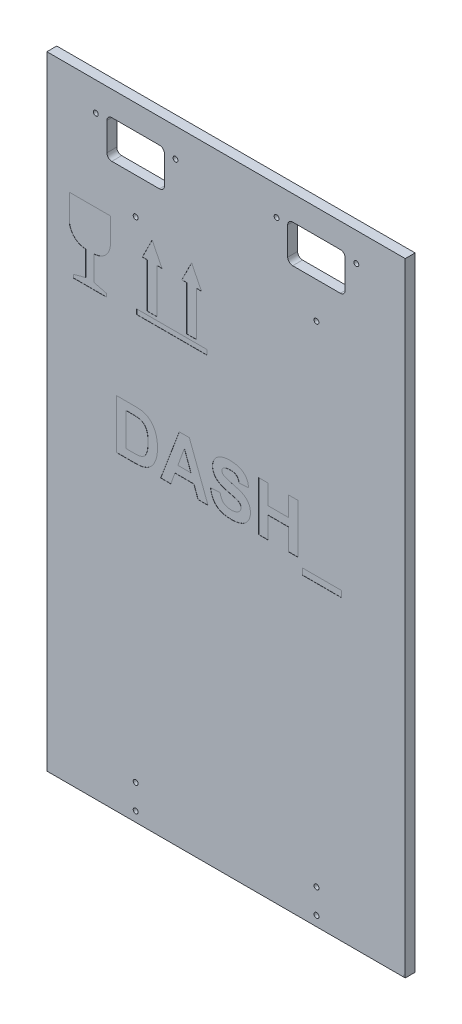
from build123d import *

# Parameters (mm, degrees)
SKETCH_1_W          = 218
SKETCH_1_H          = 379
SKETCH_1_R          = 1.5
SKETCH_1_W_2        = 35
SKETCH_1_H_2        = 23
EXTRUDE_1_DEPTH     = 6
FILLET_1_R          = 3
SKETCH_2_R          = 0.5
SKETCH_2_W          = 42.883956532
SKETCH_2_H          = 3
SKETCH_2_W_2        = 23.846153846
SKETCH_2_H_2        = 3.846153846
CUT_EXTRUDE_1_DEPTH = 0.1


with BuildPart() as part:
    # Эскиз1 → Бобышка-Вытянуть1 (new body)
    with BuildSketch(Plane.XY):
        with Locations((0, 136.5)):
            Rectangle(SKETCH_1_W, SKETCH_1_H)
        with Locations((-55, -47)):
            Circle(SKETCH_1_R, mode=Mode.SUBTRACT)
        with Locations((-55, -32)):
            Circle(SKETCH_1_R, mode=Mode.SUBTRACT)
        with Locations(Location((55, -32, 0), (0, 0, 180))):
            Circle(SKETCH_1_R, mode=Mode.SUBTRACT)
        with Locations(Location((55, -47, 0), (0, 0, 180))):
            Circle(SKETCH_1_R, mode=Mode.SUBTRACT)
        with Locations((-79.25, 308.5)):
            Circle(SKETCH_1_R, mode=Mode.SUBTRACT)
        with Locations((-55, 266)):
            Circle(SKETCH_1_R, mode=Mode.SUBTRACT)
        with Locations(Location((-30.75, 308.5, 0), (0, 0, 180))):
            Circle(SKETCH_1_R, mode=Mode.SUBTRACT)
        with Locations((30.75, 308.5)):
            Circle(SKETCH_1_R, mode=Mode.SUBTRACT)
        with Locations(Location((55, 266, 0), (0, 0, 180))):
            Circle(SKETCH_1_R, mode=Mode.SUBTRACT)
        with Locations(Location((79.25, 308.5, 0), (0, 0, 180))):
            Circle(SKETCH_1_R, mode=Mode.SUBTRACT)
        with Locations((55, 299.5)):
            Rectangle(SKETCH_1_W_2, SKETCH_1_H_2, mode=Mode.SUBTRACT)
        with Locations((-55, 299.5)):
            Rectangle(SKETCH_1_W_2, SKETCH_1_H_2, mode=Mode.SUBTRACT)
    extrude(amount=EXTRUDE_1_DEPTH)

    # Скругление1
    fillet_1_edges = [part.edges().sort_by_distance(p)[0] for p in [
        (-72.5, 311, 3),
        (-72.5, 288, 3),
        (-37.5, 288, 3),
        (-37.5, 311, 3),
        (37.5, 288, 3),
        (72.5, 288, 3),
        (72.5, 311, 3),
        (37.5, 311, 3),
    ]]
    fillet(fillet_1_edges, radius=FILLET_1_R)

    # Эскиз2 → Вырез-Вытянуть1 (cut)
    # profile 1 of 10: a face of its own
    with BuildSketch(Plane.XY.offset(6)):
        with Locations((108.386009895, -52.34308302)):
            Circle(SKETCH_2_R)
    # profile 2 of 10: a face of its own
    with BuildSketch(Plane.XY.offset(6)):
        with BuildLine():
            Line((-92.870422619, 214.808234662), (-92.870422619, 216.808234662))
            Line((-92.870422619, 216.808234662), (-85.370422619, 218.808234662))
            Line((-85.370422619, 218.808234662), (-85.370422619, 233.808234662))
            ThreePointArc((-85.370422619, 233.808234662), (-92.44149043, 236.73716685), (-95.370422619, 243.808234662))
            Line((-95.370422619, 243.808234662), (-95.370422619, 258.808234662))
            Line((-95.370422619, 258.808234662), (-70.370422619, 258.808234662))
            Line((-70.370422619, 258.808234662), (-70.370422619, 243.808234662))
            ThreePointArc((-70.370422619, 243.808234662), (-73.299354807, 236.73716685), (-80.370422619, 233.808234662))
            Line((-80.370422619, 233.808234662), (-80.370422619, 218.808234662))
            Line((-80.370422619, 218.808234662), (-72.870422619, 216.808234662))
            Line((-72.870422619, 216.808234662), (-72.870422619, 214.808234662))
            Line((-72.870422619, 214.808234662), (-92.870422619, 214.808234662))
        make_face()
    # profile 3 of 10: a face of its own
    with BuildSketch(Plane.XY.offset(6)):
        with Locations((-32.964518623, 216.308234662)):
            Rectangle(SKETCH_2_W, SKETCH_2_H)
    # profile 4 of 10: a face of its own
    with BuildSketch(Plane.XY.offset(6)):
        Polygon((-47.964518623, 219.808234662), (-47.964518623, 246.808234662), (-50.964518623, 246.808234662), (-44.964518623, 258.808234662), (-38.964518623, 246.808234662), (-41.964518623, 246.808234662), (-41.964518623, 219.808234662), align=None)
    # profile 5 of 10: a face of its own
    with BuildSketch(Plane.XY.offset(6)):
        Polygon((-23.964518623, 219.808234662), (-23.964518623, 246.808234662), (-26.964518623, 246.808234662), (-20.964518623, 258.808234662), (-14.964518623, 246.808234662), (-17.964518623, 246.808234662), (-17.964518623, 219.808234662), align=None)
    # profile 6 of 10: a face of its own
    with BuildSketch(Plane.XY.offset(6)):
        with BuildLine():
            Line((-66.730769231, 166.006273705), (-55.727163462, 166.006273705))
            add(Edge.make_bspline(
                [(-55.727163462, 166.006273705), (-55.426637124, 166.006429501), (-54.841442535, 166.006732873), (-53.992171978, 165.971500479), (-53.197994823, 165.936061326), (-52.461190552, 165.865119892), (-51.77920297, 165.79076069), (-51.150808267, 165.696616343), (-50.579976053, 165.575960059), (-50.220009582, 165.480808147), (-50.048076923, 165.435360244)],
                knots=[0, 0, 0, 0, 1.259756885, 2.453039283, 3.563158368, 4.591894114, 5.55549294, 6.43918076, 7.254497783, 8, 8, 8, 8], degree=3))
            add(Edge.make_bspline(
                [(-50.048076923, 165.435360244), (-49.833064627, 165.365284382), (-49.406912915, 165.226394889), (-48.782161397, 164.983037374), (-48.190241863, 164.681224976), (-47.609194802, 164.363963999), (-47.064959816, 163.988839795), (-46.528734918, 163.598573273), (-46.035320248, 163.146490336), (-45.388270363, 162.514674664), (-44.649937259, 161.634535447), (-43.876420826, 160.467075005), (-43.221716147, 159.185626552), (-42.774391812, 158.037493354), (-42.472341051, 157.061483153), (-42.274893764, 156.278970455), (-42.107174305, 155.454693129), (-41.96947611, 154.588443375), (-41.862488577, 153.680221075), (-41.782835219, 152.730268307), (-41.744036, 151.737764442), (-41.735251218, 151.062388403), (-41.730769231, 150.717812167)],
                knots=[0, 0, 0, 0, 0.745524535, 1.477620414, 2.207090574, 2.934465325, 3.657932502, 4.384347339, 5.118673636, 5.861150177, 7.365375624, 8.894729774, 10.468936425, 12.099947606, 12.950091786, 13.83580991, 14.759228729, 15.722225242, 16.726454549, 17.773376212, 18.863978586, 20, 20, 20, 20], degree=3))
            add(Edge.make_bspline(
                [(-41.730769231, 150.717812167), (-41.738950916, 150.122278669), (-41.75477413, 148.970528841), (-41.938087077, 147.308558647), (-42.202264191, 145.764889921), (-42.500046596, 144.801882256), (-42.644230769, 144.335600628)],
                knots=[0, 0, 0, 0, 1.103207939, 2.133582005, 3.096293362, 4, 4, 4, 4], degree=3))
            add(Edge.make_bspline(
                [(-42.644230769, 144.335600628), (-42.739440098, 144.068038066), (-42.9267317, 143.541700763), (-43.254477961, 142.782456622), (-43.608610111, 142.059923526), (-43.992065533, 141.374670745), (-44.406781558, 140.729780561), (-44.854309364, 140.127181882), (-45.327711928, 139.55894131), (-45.670664696, 139.209186548), (-45.841346154, 139.035119859)],
                knots=[0, 0, 0, 0, 1.090884612, 2.145940218, 3.175104604, 4.181306866, 5.161203701, 6.118658341, 7.063689906, 8, 8, 8, 8], degree=3))
            add(Edge.make_bspline(
                [(-45.841346154, 139.035119859), (-46.117549991, 138.786727577), (-46.687121674, 138.274507286), (-47.690804526, 137.640614204), (-48.825248379, 137.08048885), (-49.6458357, 136.792761753), (-50.072115385, 136.643292936)],
                knots=[0, 0, 0, 0, 0.908140292, 1.872714733, 2.8949153, 4, 4, 4, 4], degree=3))
            add(Edge.make_bspline(
                [(-50.072115385, 136.643292936), (-50.243714592, 136.590589709), (-50.599859868, 136.481206889), (-51.16456332, 136.364383774), (-51.767398422, 136.241309468), (-52.415316699, 136.167167607), (-53.101592444, 136.088981734), (-53.831694646, 136.045084736), (-54.603092421, 136.013920418), (-55.132175241, 136.008860403), (-55.402644231, 136.006273705)],
                knots=[0, 0, 0, 0, 0.799129865, 1.658552685, 2.566799617, 3.538529252, 4.561352959, 5.643373779, 6.795284424, 8, 8, 8, 8], degree=3))
            Line((-55.402644231, 136.006273705), (-66.730769231, 136.006273705))
            Line((-66.730769231, 136.006273705), (-66.730769231, 166.006273705))
        make_face()
        with BuildLine():
            Line((-60.961538462, 161.006273705), (-60.961538462, 141.006273705))
            Line((-60.961538462, 141.006273705), (-56.213942308, 141.006273705))
            add(Edge.make_bspline(
                [(-56.213942308, 141.006273705), (-55.999600788, 141.00797358), (-55.58691148, 141.011246488), (-54.989739484, 141.020863532), (-54.440943439, 141.046898694), (-53.937648424, 141.073866877), (-53.481164706, 141.118423035), (-53.06950605, 141.162245716), (-52.704963954, 141.223552728), (-52.479813797, 141.271947674), (-52.373798077, 141.294735244)],
                knots=[0, 0, 0, 0, 1.333384787, 2.567275092, 3.714769766, 4.750907381, 5.701951617, 6.567520054, 7.325492842, 8, 8, 8, 8], degree=3))
            add(Edge.make_bspline(
                [(-52.373798077, 141.294735244), (-52.125497243, 141.360994224), (-51.641872712, 141.49004924), (-50.962814979, 141.777750014), (-50.348355216, 142.124829524), (-49.788203103, 142.542177711), (-49.283390099, 143.069609293), (-48.85247049, 143.744152928), (-48.453665751, 144.548641375), (-48.180564171, 145.318738009), (-47.984532379, 146.006570312), (-47.85183494, 146.583884939), (-47.746967741, 147.208480989), (-47.656768273, 147.877893403), (-47.583884957, 148.591261354), (-47.538533509, 149.35116093), (-47.507580866, 150.15666194), (-47.502574826, 150.709767885), (-47.5, 150.994254474)],
                knots=[0, 0, 0, 0, 1.038686998, 2.023088296, 2.974059649, 3.888265163, 4.839857954, 5.909819677, 7.113156087, 8.466843969, 9.20827164, 10.006482943, 10.861893492, 11.769681931, 12.739021491, 13.762258324, 14.849031541, 16, 16, 16, 16], degree=3))
            add(Edge.make_bspline(
                [(-47.5, 150.994254474), (-47.502555025, 151.278741938), (-47.507504589, 151.829847752), (-47.538409758, 152.629342569), (-47.583506461, 153.37727584), (-47.656908827, 154.074572137), (-47.745710057, 154.722195162), (-47.851805597, 155.320692963), (-47.983703117, 155.866137779), (-48.179901647, 156.514136293), (-48.477328512, 157.242506751), (-48.882068429, 158.038867619), (-49.379102977, 158.717628415), (-49.928277756, 159.307279011), (-50.561485552, 159.792531657), (-51.262445052, 160.198959009), (-52.046418148, 160.514411955), (-52.60408284, 160.648773713), (-52.890625, 160.717812167)],
                knots=[0, 0, 0, 0, 1.117996097, 2.165769068, 3.143980016, 4.062055362, 4.920439205, 5.712587309, 6.449616741, 7.124491204, 8.371470382, 9.537068822, 10.625202851, 11.666538334, 12.693249444, 13.747832046, 14.842779399, 16, 16, 16, 16], degree=3))
            add(Edge.make_bspline(
                [(-52.890625, 160.717812167), (-53.014654406, 160.740858567), (-53.287719685, 160.791597919), (-53.740845236, 160.850861776), (-54.272462473, 160.894840622), (-54.885281476, 160.939739162), (-55.576820891, 160.965365835), (-56.349974279, 160.992111431), (-57.201506365, 161.001247678), (-57.796476492, 161.004550221), (-58.106971154, 161.006273705)],
                knots=[0, 0, 0, 0, 0.578738571, 1.274160813, 2.095454135, 3.025967819, 4.093109015, 5.270126069, 6.575371698, 8, 8, 8, 8], degree=3))
            Line((-58.106971154, 161.006273705), (-60.961538462, 161.006273705))
        make_face(mode=Mode.SUBTRACT)
    # profile 7 of 10: a face of its own
    with BuildSketch(Plane.XY.offset(6)):
        Polygon((-10.961538462, 136.006273705), (-17.079326923, 136.006273705), (-19.609375, 142.929350628), (-31.123798077, 142.929350628), (-33.653846154, 136.006273705), (-39.807692308, 136.006273705), (-28.467548077, 166.006273705), (-22.355769231, 166.006273705), align=None)
        Polygon((-21.442307692, 147.929350628), (-25.384615385, 158.698581398), (-29.314903846, 147.929350628), align=None, mode=Mode.SUBTRACT)
    # profile 8 of 10: a face of its own
    with BuildSketch(Plane.XY.offset(6)):
        with BuildLine():
            Line((-9.423076923, 146.006273705), (-3.653846154, 146.39088909))
            add(Edge.make_bspline(
                [(-3.653846154, 146.39088909), (-3.607884326, 146.149524791), (-3.518606398, 145.680689992), (-3.320247605, 145.012536396), (-3.101909473, 144.389627747), (-2.840983438, 143.818643697), (-2.555336081, 143.289029928), (-2.221501358, 142.815873858), (-1.862768428, 142.384068817), (-1.461379322, 142.009123402), (-1.0240711, 141.680741027), (-0.548661639, 141.400685599), (-0.040302405, 141.158292566), (0.502249593, 140.958689588), (1.084586189, 140.809684992), (1.701634376, 140.703677055), (2.354279114, 140.635792501), (2.80030982, 140.626446835), (3.028846154, 140.621658321)],
                knots=[0, 0, 0, 0, 1.204560339, 2.339781841, 3.415289417, 4.440034832, 5.416475564, 6.362424008, 7.275913008, 8.16578645, 9.05021719, 9.95355393, 10.867835453, 11.809845306, 12.784702352, 13.812224031, 14.87903166, 16, 16, 16, 16], degree=3))
            add(Edge.make_bspline(
                [(3.028846154, 140.621658321), (3.269395102, 140.624282695), (3.737275195, 140.629387237), (4.415285184, 140.69271357), (5.049255318, 140.783435357), (5.633587423, 140.927045818), (6.179193341, 141.087651396), (6.67252249, 141.307376935), (7.121558108, 141.56079858), (7.525143379, 141.848366486), (7.877352623, 142.167299928), (8.185482847, 142.500256094), (8.453843917, 142.840041607), (8.665063072, 143.201734661), (8.835999901, 143.57070689), (8.948977175, 143.957965373), (9.025300013, 144.35461782), (9.034052019, 144.625702732), (9.038461538, 144.762283321)],
                knots=[0, 0, 0, 0, 1.417779877, 2.757654889, 4.012140507, 5.189587551, 6.302846416, 7.360586765, 8.365575446, 9.33904572, 10.275781718, 11.161696098, 12.012180333, 12.822428111, 13.625933072, 14.403138519, 15.195454004, 16, 16, 16, 16], degree=3))
            add(Edge.make_bspline(
                [(9.038461538, 144.762283321), (9.033053638, 144.933407719), (9.022473873, 145.268187561), (8.895104095, 145.746792018), (8.704092604, 146.190205218), (8.416495303, 146.591877946), (8.029893744, 146.958948277), (7.536744928, 147.30233359), (6.923283375, 147.61124607), (6.468174701, 147.783558028), (6.225961538, 147.87526409)],
                knots=[0, 0, 0, 0, 0.90494901, 1.770400303, 2.607161909, 3.452839393, 4.36912122, 5.420987164, 6.627424851, 8, 8, 8, 8], degree=3))
            add(Edge.make_bspline(
                [(6.225961538, 147.87526409), (6.122034283, 147.910090592), (5.889461966, 147.988026649), (5.492718286, 148.099467861), (5.014829981, 148.238628326), (4.448891268, 148.396806409), (3.79509244, 148.558580948), (3.060735572, 148.757868826), (2.236868042, 148.956176552), (1.660489326, 149.102567271), (1.358173077, 149.179350628)],
                knots=[0, 0, 0, 0, 0.521821638, 1.167752076, 1.961721917, 2.891982557, 3.96540661, 5.168436773, 6.514817513, 8, 8, 8, 8], degree=3))
            add(Edge.make_bspline(
                [(1.358173077, 149.179350628), (0.964467596, 149.277649699), (0.204877251, 149.467301681), (-0.878472521, 149.80467912), (-1.876257474, 150.139882283), (-2.778870554, 150.503595703), (-3.596267959, 150.871169543), (-4.315228039, 151.268409922), (-4.950753915, 151.674686733), (-5.321089593, 151.978347948), (-5.498798077, 152.124062167)],
                knots=[0, 0, 0, 0, 1.293880989, 2.496331788, 3.617634808, 4.64976062, 5.598842568, 6.473791081, 7.267636666, 8, 8, 8, 8], degree=3))
            add(Edge.make_bspline(
                [(-5.498798077, 152.124062167), (-5.719179697, 152.330404529), (-6.15125824, 152.734957811), (-6.720022582, 153.399716498), (-7.197939502, 154.101927689), (-7.591317449, 154.836408131), (-7.894211029, 155.607386197), (-8.108898102, 156.409701279), (-8.247851376, 157.245447334), (-8.2620306, 157.814610196), (-8.269230769, 158.103629474)],
                knots=[0, 0, 0, 0, 1.064429417, 2.086912298, 3.078678339, 4.055528992, 5.020032834, 5.993708893, 6.981211098, 8, 8, 8, 8], degree=3))
            add(Edge.make_bspline(
                [(-8.269230769, 158.103629474), (-8.255208381, 158.477616973), (-8.22739215, 159.219496534), (-7.972299178, 160.309958217), (-7.574934029, 161.362169756), (-7.11408468, 162.197664682), (-6.671307887, 162.829719754), (-6.303613993, 163.283276688), (-5.899666728, 163.707762378), (-5.453932869, 164.092822271), (-4.982963621, 164.461011532), (-4.468511819, 164.787968006), (-3.925163734, 165.095942916), (-3.138877149, 165.461032843), (-2.071315722, 165.841492408), (-0.682360951, 166.162195676), (0.829935757, 166.354979763), (1.878415719, 166.378630295), (2.421875, 166.39088909)],
                knots=[0, 0, 0, 0, 1.180131776, 2.341029169, 3.518901375, 4.725685298, 5.343762192, 5.955650671, 6.568945152, 7.192346361, 7.815201106, 8.455999361, 9.116257477, 9.787318263, 11.192748436, 12.688084276, 14.283332633, 16, 16, 16, 16], degree=3))
            add(Edge.make_bspline(
                [(2.421875, 166.39088909), (2.866859919, 166.384938525), (3.732346074, 166.373364804), (4.986968788, 166.256329507), (6.158854475, 166.074177905), (7.243890852, 165.812700131), (8.242583467, 165.467219359), (9.158803545, 165.055686439), (9.991772523, 164.567093595), (10.731349826, 163.998636971), (11.390242314, 163.371950001), (11.965020634, 162.687425948), (12.45788228, 161.953709927), (12.872008118, 161.171338136), (13.197220048, 160.336288041), (13.436075371, 159.449601617), (13.594056354, 158.513365906), (13.633654766, 157.871847844), (13.653846154, 157.544735244)],
                knots=[0, 0, 0, 0, 1.325124071, 2.577337985, 3.749592149, 4.855247722, 5.896868755, 6.892903601, 7.842551483, 8.766257401, 9.665194363, 10.546067736, 11.423174165, 12.293291263, 13.177512979, 14.086532529, 15.024315359, 16, 16, 16, 16], degree=3))
            Line((13.653846154, 157.544735244), (7.884615385, 157.160119859))
            add(Edge.make_bspline(
                [(7.884615385, 157.160119859), (7.851334149, 157.341027463), (7.786472484, 157.693597568), (7.645445457, 158.198549592), (7.486373816, 158.665572618), (7.300188701, 159.09466365), (7.075299579, 159.478137265), (6.830555583, 159.828057741), (6.559205349, 160.139762586), (6.25226436, 160.404716317), (5.920280424, 160.645813355), (5.54193574, 160.83905821), (5.133083362, 161.018346899), (4.678168941, 161.153128029), (4.185928484, 161.260041263), (3.656075267, 161.339299787), (3.087510975, 161.377998258), (2.696359697, 161.386493777), (2.493990385, 161.39088909)],
                knots=[0, 0, 0, 0, 1.151066407, 2.24330871, 3.278475654, 4.238599069, 5.165719782, 6.056502506, 6.909492653, 7.744782051, 8.590364415, 9.471203867, 10.39832458, 11.382154319, 12.435022857, 13.550631277, 14.73277401, 16, 16, 16, 16], degree=3))
            add(Edge.make_bspline(
                [(2.493990385, 161.39088909), (2.283581565, 161.387008752), (1.874221805, 161.37945938), (1.277675529, 161.333129995), (0.718070362, 161.247610412), (0.192657929, 161.136285131), (-0.297859946, 160.984834783), (-0.752448117, 160.800165894), (-1.173186364, 160.582753762), (-1.4297342, 160.411701403), (-1.556490385, 160.327187167)],
                knots=[0, 0, 0, 0, 1.186678824, 2.308736671, 3.37120409, 4.377216403, 5.334874112, 6.262130804, 7.141346615, 8, 8, 8, 8], degree=3))
            add(Edge.make_bspline(
                [(-1.556490385, 160.327187167), (-1.701552195, 160.211738319), (-1.982491894, 159.988149736), (-2.28484246, 159.544178831), (-2.4668582, 159.042727006), (-2.488765858, 158.688116347), (-2.5, 158.506273705)],
                knots=[0, 0, 0, 0, 1.037857257, 2.010007357, 2.979541333, 4, 4, 4, 4], degree=3))
            add(Edge.make_bspline(
                [(-2.5, 158.506273705), (-2.49081252, 158.336329683), (-2.472714646, 158.001567005), (-2.29017428, 157.526029375), (-2.009452065, 157.085409555), (-1.7471632, 156.846059095), (-1.610576923, 156.721417936)],
                knots=[0, 0, 0, 0, 0.98538058, 1.941042925, 2.927803204, 4, 4, 4, 4], degree=3))
            add(Edge.make_bspline(
                [(-1.610576923, 156.721417936), (-1.502178113, 156.640519571), (-1.259951892, 156.459745396), (-0.816241469, 156.229964319), (-0.280671345, 155.981097531), (0.358968187, 155.737802768), (1.098426095, 155.494959624), (1.937747349, 155.241403309), (2.877448167, 154.984442761), (3.893576039, 154.735589058), (4.925232017, 154.490980163), (5.90971289, 154.223553601), (6.825138529, 153.962833385), (7.667264365, 153.689556291), (8.440431402, 153.423521886), (9.140883867, 153.150285393), (9.77343134, 152.884183623), (10.511051818, 152.518274838), (11.347070442, 152.022636602), (12.223312269, 151.302143767), (12.998236352, 150.492262764), (13.538182858, 149.728600843), (13.909097854, 149.07183127), (14.147927975, 148.548309446), (14.354534764, 147.99664945), (14.522712127, 147.416241657), (14.644600249, 146.806269363), (14.745469763, 146.171392762), (14.797005868, 145.506339063), (14.804091823, 145.052819763), (14.807692308, 144.822379474)],
                knots=[0, 0, 0, 0, 0.511875881, 1.143829537, 1.88775736, 2.750598373, 3.734912702, 4.837306479, 6.073130119, 7.42648979, 8.801963576, 10.091065733, 11.292408984, 12.408830014, 13.446061236, 14.39066453, 15.257936293, 16.045629259, 17.510392066, 18.929669597, 20.331293837, 21.746891395, 22.460690638, 23.187651344, 23.925159671, 24.69163991, 25.474819891, 26.281170188, 27.126635539, 28, 28, 28, 28], degree=3))
            add(Edge.make_bspline(
                [(14.807692308, 144.822379474), (14.802741526, 144.609862008), (14.792909752, 144.187822907), (14.724202651, 143.561410337), (14.617948843, 142.946121697), (14.460656701, 142.341185645), (14.251992624, 141.74779222), (14.017053454, 141.157377114), (13.723275251, 140.582816039), (13.388915586, 140.023633119), (13.020101686, 139.480247982), (12.602167032, 138.978987568), (12.159659472, 138.503128626), (11.664303955, 138.079316599), (11.146689792, 137.673235192), (10.583141849, 137.313602674), (9.98686323, 136.988167083), (9.354083772, 136.69935813), (8.682559918, 136.447687233), (7.973163845, 136.223682635), (7.219504316, 136.040352078), (6.427865777, 135.883214696), (5.595351186, 135.763715777), (4.723001367, 135.680277746), (3.810618007, 135.633223725), (3.189154996, 135.625561355), (2.872596154, 135.621658321)],
                knots=[0, 0, 0, 0, 0.900570041, 1.788444861, 2.667795364, 3.545012114, 4.433698372, 5.332345486, 6.235991676, 7.164928091, 8.092777575, 9.015680987, 9.928493428, 10.842962589, 11.775229507, 12.714851019, 13.672254427, 14.652424454, 15.660007982, 16.709910502, 17.803296389, 18.945495772, 20.129342395, 21.366102753, 22.658353839, 24, 24, 24, 24], degree=3))
            add(Edge.make_bspline(
                [(2.872596154, 135.621658321), (2.415534029, 135.629120637), (1.525623232, 135.643649944), (0.232742673, 135.773698673), (-0.979893703, 135.972747633), (-2.110311815, 136.261634819), (-3.159893309, 136.632500758), (-4.12815948, 137.089325703), (-5.010426941, 137.634838943), (-5.817623039, 138.255810863), (-6.538993159, 138.963557139), (-7.187650624, 139.743413533), (-7.754844861, 140.602402516), (-8.24020306, 141.539180524), (-8.65599591, 142.548683341), (-8.998904277, 143.631374518), (-9.257096255, 144.79241791), (-9.366793156, 145.594657232), (-9.423076923, 146.006273705)],
                knots=[0, 0, 0, 0, 1.217954099, 2.371385517, 3.459848295, 4.490682126, 5.476952527, 6.422732854, 7.338496285, 8.236688651, 9.131557988, 10.026443255, 10.935708282, 11.869506048, 12.834296687, 13.842423496, 14.892981177, 16, 16, 16, 16], degree=3))
        make_face()
    # profile 9 of 10: a face of its own
    with BuildSketch(Plane.XY.offset(6)):
        Polygon((19.807692308, 136.006273705), (19.807692308, 166.006273705), (25.576923077, 166.006273705), (25.576923077, 154.083196782), (37.884615385, 154.083196782), (37.884615385, 166.006273705), (43.653846154, 166.006273705), (43.653846154, 136.006273705), (37.884615385, 136.006273705), (37.884615385, 149.083196782), (25.576923077, 149.083196782), (25.576923077, 136.006273705), align=None)
    # profile 10 of 10: a face of its own
    with BuildSketch(Plane.XY.offset(6)):
        with Locations((58.269230769, 129.852427551)):
            Rectangle(SKETCH_2_W_2, SKETCH_2_H_2)
    extrude(amount=-CUT_EXTRUDE_1_DEPTH, mode=Mode.SUBTRACT)


solid = part.part
